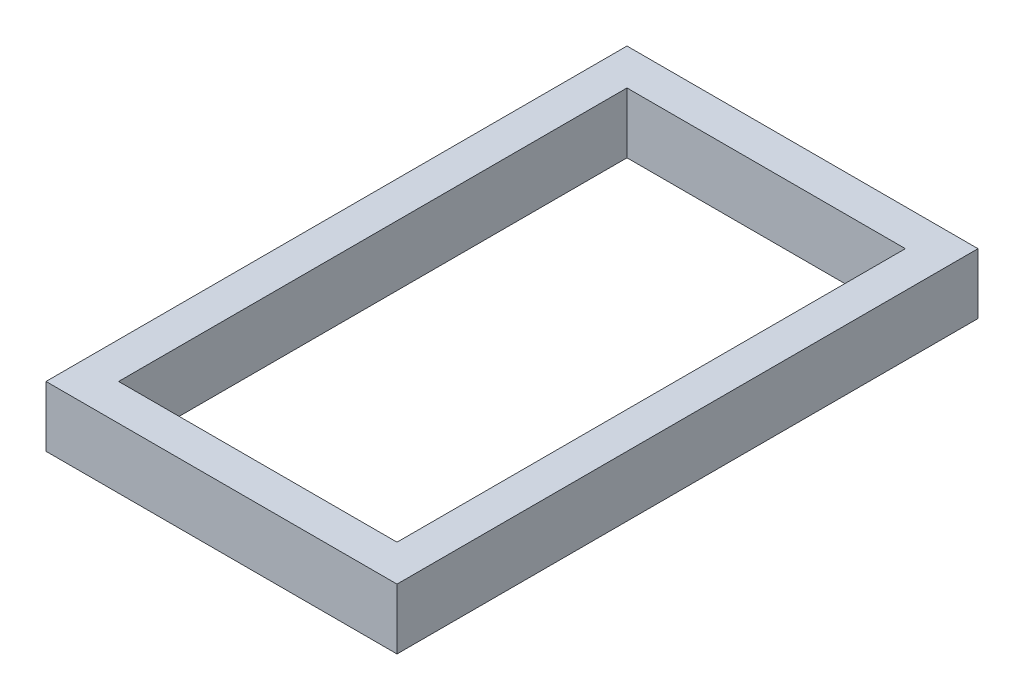
from build123d import *

# Parameters (mm, degrees)
SKETCH1_W           = 29
SKETCH1_H           = 48
SKETCH1_W_2         = 23
SKETCH1_H_2         = 42
BOSS_EXTRUDE1_DEPTH = 5


with BuildPart() as part:
    # Sketch1 → Boss-Extrude1 (new body)
    with BuildSketch(Plane(origin=(0, 0, 0), x_dir=(1, 0, 0), z_dir=(0, 1, 0))):
        Rectangle(SKETCH1_W, SKETCH1_H)
        Rectangle(SKETCH1_W_2, SKETCH1_H_2, mode=Mode.SUBTRACT)
    extrude(amount=BOSS_EXTRUDE1_DEPTH)


solid = part.part
